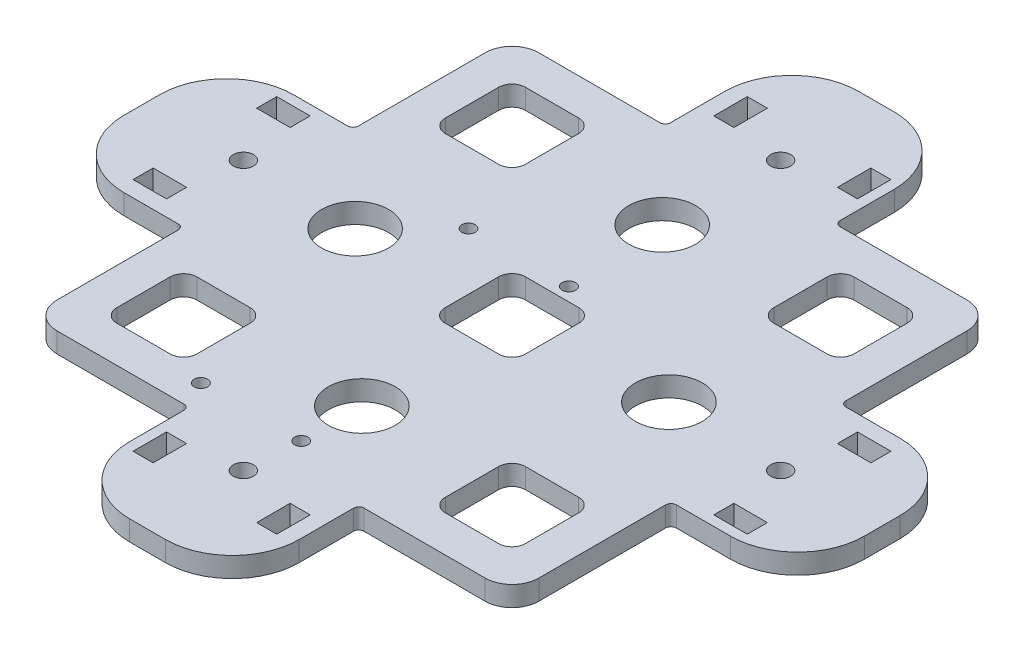
from build123d import *

# Parameters (mm, degrees)
SKETCH1_R           = 1.5
BOSS_EXTRUDE1_DEPTH = 3
SKETCH2_R           = 1
SKETCH2_R_2         = 5
CUT_EXTRUDE1_DEPTH  = 3
SKETCH3_W           = 5
SKETCH3_H           = 3
SKETCH3_W_2         = 3
SKETCH3_H_2         = 5
CUT_EXTRUDE3_DEPTH  = 3


with BuildPart() as part:
    # Sketch1 → Boss-Extrude1 (new body)
    with BuildSketch(Plane(origin=(0, 0, 0), x_dir=(1, 0, 0), z_dir=(0, 1, 0))):
        with BuildLine():
            Line((36.795388519, -12.237658296), (44.9, -12.237658296))
            ThreePointArc((44.9, -12.237658296), (51.971067812, -9.308726108), (54.9, -2.237658296))
            Line((54.9, -2.237658296), (54.9, 3.1))
            ThreePointArc((54.9, 3.1), (51.971067812, 10.171067812), (44.9, 13.1))
            Line((44.9, 13.1), (36.795388519, 13.1))
            ThreePointArc((36.795388519, 13.1), (36.232963903, 13.332963903), (36, 13.895388519))
            Line((36, 13.895388519), (36, 32))
            ThreePointArc((36, 32), (34.828427125, 34.828427125), (32, 36))
            Line((32, 36), (13.033046814, 36))
            ThreePointArc((13.033046814, 36), (12.470622199, 36.232963903), (12.237658296, 36.795388519))
            Line((12.237658296, 36.795388519), (12.237658296, 44.9))
            ThreePointArc((12.237658296, 44.9), (9.308726108, 51.971067812), (2.237658296, 54.9))
            Line((2.237658296, 54.9), (-3.1, 54.9))
            ThreePointArc((-3.1, 54.9), (-10.171067812, 51.971067812), (-13.1, 44.9))
            Line((-13.1, 44.9), (-13.1, 36.795388519))
            ThreePointArc((-13.1, 36.795388519), (-13.332963903, 36.232963903), (-13.895388519, 36))
            Line((-13.895388519, 36), (-32, 36))
            ThreePointArc((-32, 36), (-34.828427125, 34.828427125), (-36, 32))
            Line((-36, 32), (-36, 13.033046814))
            ThreePointArc((-36, 13.033046814), (-36.232963903, 12.470622199), (-36.795388519, 12.237658296))
            Line((-36.795388519, 12.237658296), (-44.9, 12.237658296))
            ThreePointArc((-44.9, 12.237658296), (-51.971067812, 9.308726108), (-54.9, 2.237658296))
            Line((-54.9, 2.237658296), (-54.9, -3.1))
            ThreePointArc((-54.9, -3.1), (-51.971067812, -10.171067812), (-44.9, -13.1))
            Line((-44.9, -13.1), (-36.795388519, -13.1))
            ThreePointArc((-36.795388519, -13.1), (-36.232963903, -13.332963903), (-36, -13.895388519))
            Line((-36, -13.895388519), (-36, -32))
            ThreePointArc((-36, -32), (-34.828427125, -34.828427125), (-32, -36))
            Line((-32, -36), (-13.033046814, -36))
            ThreePointArc((-13.033046814, -36), (-12.470622199, -36.232963903), (-12.237658296, -36.795388519))
            Line((-12.237658296, -36.795388519), (-12.237658296, -44.9))
            ThreePointArc((-12.237658296, -44.9), (-9.308726108, -51.971067812), (-2.237658296, -54.9))
            Line((-2.237658296, -54.9), (3.1, -54.9))
            ThreePointArc((3.1, -54.9), (10.171067812, -51.971067812), (13.1, -44.9))
            Line((13.1, -44.9), (13.1, -36.795388519))
            ThreePointArc((13.1, -36.795388519), (13.332963903, -36.232963903), (13.895388519, -36))
            Line((13.895388519, -36), (32, -36))
            ThreePointArc((32, -36), (34.828427125, -34.828427125), (36, -32))
            Line((36, -32), (36, -13.033046814))
            ThreePointArc((36, -13.033046814), (36.232963903, -12.470622199), (36.795388519, -12.237658296))
        make_face()
        with Locations(Location((40.15, 0, 0), (0, 0, 270))):
            Circle(SKETCH1_R, mode=Mode.SUBTRACT)
        with Locations(Location((0, -40.15, 0), (0, 0, 270))):
            Circle(SKETCH1_R, mode=Mode.SUBTRACT)
        with Locations(Location((-40.15, 0, 0), (0, 0, 270))):
            Circle(SKETCH1_R, mode=Mode.SUBTRACT)
        with Locations(Location((0, 40.15, 0), (0, 0, 270))):
            Circle(SKETCH1_R, mode=Mode.SUBTRACT)
        with BuildLine():
            Line((20.560920379, 18.560920379), (28.535, 18.560920379))
            ThreePointArc((28.535, 18.560920379), (29.949213562, 19.146706817), (30.535, 20.560920379))
            Line((30.535, 20.560920379), (30.535, 28.535))
            ThreePointArc((30.535, 28.535), (29.949213562, 29.949213562), (28.535, 30.535))
            Line((28.535, 30.535), (20.560920379, 30.535))
            ThreePointArc((20.560920379, 30.535), (19.146706817, 29.949213562), (18.560920379, 28.535))
            Line((18.560920379, 28.535), (18.560920379, 20.560920379))
            ThreePointArc((18.560920379, 20.560920379), (19.146706817, 19.146706817), (20.560920379, 18.560920379))
        make_face(mode=Mode.SUBTRACT)
        with BuildLine():
            Line((4, -6), (-4, -6))
            ThreePointArc((-4, -6), (-5.414213562, -5.414213562), (-6, -4))
            Line((-6, -4), (-6, 4))
            ThreePointArc((-6, 4), (-5.414213562, 5.414213562), (-4, 6))
            Line((-4, 6), (4, 6))
            ThreePointArc((4, 6), (5.414213562, 5.414213562), (6, 4))
            Line((6, 4), (6, -4))
            ThreePointArc((6, -4), (5.414213562, -5.414213562), (4, -6))
        make_face(mode=Mode.SUBTRACT)
        with BuildLine():
            Line((-20.560920379, 18.560920379), (-28.535, 18.560920379))
            ThreePointArc((-28.535, 18.560920379), (-29.949213562, 19.146706817), (-30.535, 20.560920379))
            Line((-30.535, 20.560920379), (-30.535, 28.535))
            ThreePointArc((-30.535, 28.535), (-29.949213562, 29.949213562), (-28.535, 30.535))
            Line((-28.535, 30.535), (-20.560920379, 30.535))
            ThreePointArc((-20.560920379, 30.535), (-19.146706817, 29.949213562), (-18.560920379, 28.535))
            Line((-18.560920379, 28.535), (-18.560920379, 20.560920379))
            ThreePointArc((-18.560920379, 20.560920379), (-19.146706817, 19.146706817), (-20.560920379, 18.560920379))
        make_face(mode=Mode.SUBTRACT)
        with BuildLine():
            Line((18.560920379, -20.560920379), (18.560920379, -28.535))
            ThreePointArc((18.560920379, -28.535), (19.146706817, -29.949213562), (20.560920379, -30.535))
            Line((20.560920379, -30.535), (28.535, -30.535))
            ThreePointArc((28.535, -30.535), (29.949213562, -29.949213562), (30.535, -28.535))
            Line((30.535, -28.535), (30.535, -20.560920379))
            ThreePointArc((30.535, -20.560920379), (29.949213562, -19.146706817), (28.535, -18.560920379))
            Line((28.535, -18.560920379), (20.560920379, -18.560920379))
            ThreePointArc((20.560920379, -18.560920379), (19.146706817, -19.146706817), (18.560920379, -20.560920379))
        make_face(mode=Mode.SUBTRACT)
        with BuildLine():
            Line((-20.560920379, -18.560920379), (-28.535, -18.560920379))
            ThreePointArc((-28.535, -18.560920379), (-29.949213562, -19.146706817), (-30.535, -20.560920379))
            Line((-30.535, -20.560920379), (-30.535, -28.535))
            ThreePointArc((-30.535, -28.535), (-29.949213562, -29.949213562), (-28.535, -30.535))
            Line((-28.535, -30.535), (-20.560920379, -30.535))
            ThreePointArc((-20.560920379, -30.535), (-19.146706817, -29.949213562), (-18.560920379, -28.535))
            Line((-18.560920379, -28.535), (-18.560920379, -20.560920379))
            ThreePointArc((-18.560920379, -20.560920379), (-19.146706817, -19.146706817), (-20.560920379, -18.560920379))
        make_face(mode=Mode.SUBTRACT)
    extrude(amount=BOSS_EXTRUDE1_DEPTH)

    # Sketch2 → Cut-Extrude1 (cut)
    with BuildSketch(Plane(origin=(0, 3, 0), x_dir=(1, 0, 0), z_dir=(0, 1, 0))):
        with Locations(Location((-14.5, -32, 0), (0, 0, 270))):
            Circle(SKETCH2_R)
        with Locations(Location((0.5, -32, 0), (0, 0, 270))):
            Circle(SKETCH2_R)
        with Locations(Location((-14.5, 8, 0), (0, 0, 270))):
            Circle(SKETCH2_R)
        with Locations(Location((0.5, 8, 0), (0, 0, 270))):
            Circle(SKETCH2_R)
        with Locations(Location((0.5, -22.947694259, 0), (0, 0, 270))):
            Circle(SKETCH2_R_2)
        with Locations(Location((-22.947694259, -0.5, 0), (0, 0, 270))):
            Circle(SKETCH2_R_2)
        with Locations(Location((-0.5, 22.947694259, 0), (0, 0, 270))):
            Circle(SKETCH2_R_2)
        with Locations(Location((22.947694259, 0.5, 0), (0, 0, 270))):
            Circle(SKETCH2_R_2)
    extrude(amount=-CUT_EXTRUDE1_DEPTH, mode=Mode.SUBTRACT)

    # Sketch3 → Cut-Extrude3 (cut)
    with BuildSketch(Plane(origin=(0, 3, 0), x_dir=(1, 0, 0), z_dir=(0, 1, 0))):
        with Locations((-43.4, 9.237658296)):
            Rectangle(SKETCH3_W, SKETCH3_H)
        with Locations((-43.4, -9.237658296)):
            Rectangle(SKETCH3_W, SKETCH3_H)
        with Locations((9.237658296, 43.4)):
            Rectangle(SKETCH3_W_2, SKETCH3_H_2)
        with Locations((-9.237658296, 43.4)):
            Rectangle(SKETCH3_W_2, SKETCH3_H_2)
        with Locations((43.4, -9.237658296)):
            Rectangle(SKETCH3_W, SKETCH3_H)
        with Locations((43.4, 9.237658296)):
            Rectangle(SKETCH3_W, SKETCH3_H)
        with Locations((-9.237658296, -43.4)):
            Rectangle(SKETCH3_W_2, SKETCH3_H_2)
        with Locations((9.237658296, -43.4)):
            Rectangle(SKETCH3_W_2, SKETCH3_H_2)
    extrude(amount=-CUT_EXTRUDE3_DEPTH, mode=Mode.SUBTRACT)


solid = part.part
